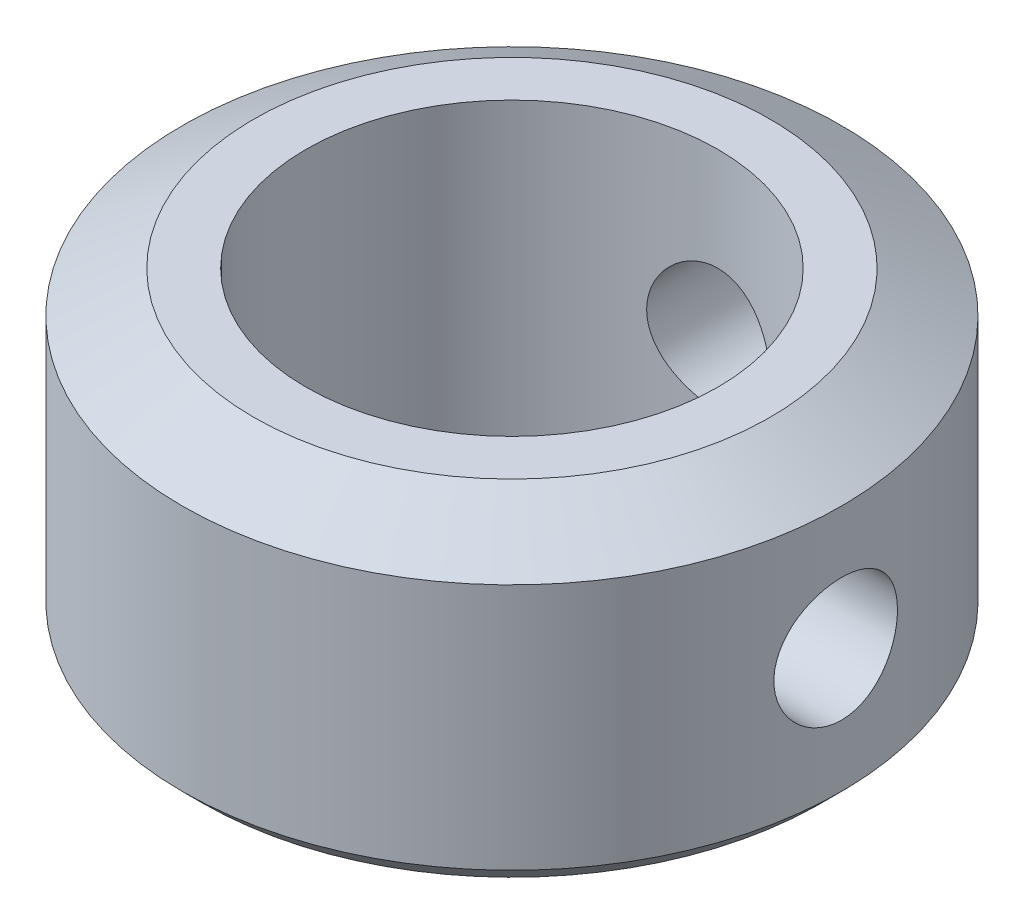
from build123d import *

# Parameters (mm, degrees)
SKETCH1_R           = 8
SKETCH1_R_2         = 5
BOSS_EXTRUDE1_DEPTH = 7.5
CHAMFER1_SIZE       = 1
CHAMFER1_SIZE2      = 1.732050808
CHAMFER2_SIZE       = 0.5
CHAMFER3_SIZE       = 0.2
CUT_EXTRUDE1_REACH  = 21.397
SKETCH2_R           = 1.5
CIRPATTERN1_COUNT   = 2
CIRPATTERN1_ANGLE   = 90


with BuildPart() as part:
    # Sketch1 → Boss-Extrude1 (new body)
    with BuildSketch(Plane(origin=(0, 0, 0), x_dir=(1, 0, 0), z_dir=(0, 1, 0))):
        Circle(SKETCH1_R)
        Circle(SKETCH1_R_2, mode=Mode.SUBTRACT)
    extrude(amount=BOSS_EXTRUDE1_DEPTH)

    # Chamfer1
    chamfer1_edges = [part.edges().sort_by_distance(p)[0] for p in [
        (-8, 7.5, 0),
    ]]
    chamfer1_side = [part.faces().sort_by_distance(p)[0] for p in [
        (-8, 3.75, 0),
    ]]
    chamfer(chamfer1_edges, length=CHAMFER1_SIZE, length2=CHAMFER1_SIZE2, reference=chamfer1_side[0])

    # Chamfer2
    chamfer2_edges = [part.edges().sort_by_distance(p)[0] for p in [
        (-8, 0, 0),
    ]]
    chamfer(chamfer2_edges, length=CHAMFER2_SIZE)

    # Chamfer3
    chamfer3_edges = [part.edges().sort_by_distance(p)[0] for p in [
        (-5, 0, 0),
    ]]
    chamfer(chamfer3_edges, length=CHAMFER3_SIZE)

    # Sketch2 → Cut-Extrude1 (cut, up to next)
    with BuildSketch(Plane(origin=(8, 0, 0), x_dir=(0, 0, -1), z_dir=(1, 0, 0)), mode=Mode.PRIVATE) as cut_extrude1_sk1:
        with Locations((0, 3.5)):
            Circle(SKETCH2_R)
    cut_extrude1_tool1 = extrude(cut_extrude1_sk1.sketch, amount=-CUT_EXTRUDE1_REACH, mode=Mode.PRIVATE) & part.part
    cut_extrude1 = cut_extrude1_tool1.solids().sort_by_distance((8, 3.5, 0))[0]
    add(cut_extrude1, mode=Mode.SUBTRACT)

    # CirPattern1: Cut-Extrude1 ×2 about axis
    cirpattern1_axis = Axis((0, 7.5, 0), (0, 1, 0))
    for i in range(1, CIRPATTERN1_COUNT):
        add(cut_extrude1.rotate(cirpattern1_axis, i * CIRPATTERN1_ANGLE / (CIRPATTERN1_COUNT - 1)), mode=Mode.SUBTRACT)


solid = part.part
